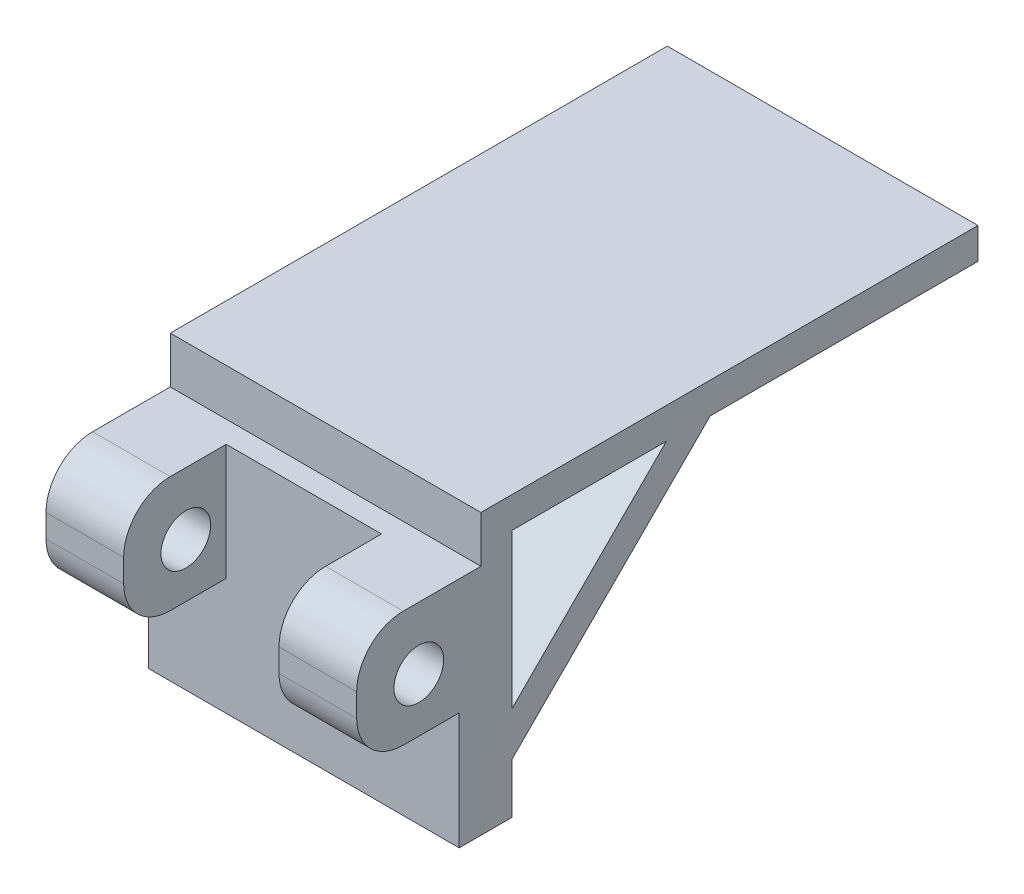
from build123d import *

# Parameters (mm, degrees)
BOSS_EXTRUDE1_DEPTH = 8
SKETCH1_3_W         = 10
SKETCH1_3_H         = 7.5
BOSS_EXTRUDE2_DEPTH = 2
SKETCH2_R           = 1.6
CUT_EXTRUDE1_DEPTH  = 23.808989456
CUT_EXTRUDE3_DEPTH  = 8
FILLET1_R           = 3
BOSS_EXTRUDE3_DEPTH = 3
SKETCH5_W           = 20
SKETCH5_H           = 2
BOSS_EXTRUDE4_DEPTH = 30
BOSS_EXTRUDE5_DEPTH = 20
BOSS_EXTRUDE6_DEPTH = 1.4


with BuildPart() as part:
    # Sketch1 → Boss-Extrude1 (new body)
    with BuildSketch(Plane.XY):
        Polygon((-10, 7.5), (-10, -7.5), (10, -7.5), (10, 7.5), (5, 7.5), (5, 0), (-5, 0), (-5, 7.5), align=None)
    extrude(amount=BOSS_EXTRUDE1_DEPTH)

    # Sketch1<3> → Boss-Extrude2 (add)
    with BuildSketch(Plane.XY):
        Polygon((-10, 7.5), (-10, -7.5), (10, -7.5), (10, 7.5), (5, 7.5), (5, 0), (-5, 0), (-5, 7.5), align=None)
        with Locations((0, 3.75)):
            Rectangle(SKETCH1_3_W, SKETCH1_3_H)
    extrude(amount=-BOSS_EXTRUDE2_DEPTH)

    # Sketch2 → Cut-Extrude1 (cut, through all)
    with BuildSketch(Plane(origin=(10, 0, 0), x_dir=(0, 0, -1), z_dir=(1, 0, 0))):
        with Locations(Location((-4, 3.5, 0), (0, 0, 90))):
            Circle(SKETCH2_R)
    extrude(amount=-CUT_EXTRUDE1_DEPTH, mode=Mode.SUBTRACT)

    # Sketch3 → Cut-Extrude3 (cut)
    with BuildSketch(Plane.XY.offset(8)):
        Polygon((10, -7.5), (10, 0.026252142), (5, 0.026252142), (5, 0), (-5, 0), (-5, 0.026252142), (-10, 0.026252142), (-10, -7.5), align=None)
    extrude(amount=-CUT_EXTRUDE3_DEPTH, mode=Mode.SUBTRACT)

    # Fillet1
    fillet1_edges = [part.edges().sort_by_distance(p)[0] for p in [
        (-7.5, 7.5, 8),
        (7.5, 0.026252142, 8),
        (7.5, 7.5, 8),
        (-7.5, 0.026252142, 8),
    ]]
    fillet(fillet1_edges, radius=FILLET1_R)

    # Sketch4 → Boss-Extrude3 (add)
    with BuildSketch(Plane(origin=(0, 7.5, 0), x_dir=(1, 0, 0), z_dir=(0, 1, 0))):
        Polygon((-5, 0), (5, 0), (10, 0), (10, 2), (-10, 2), (-10, 0), align=None)
    extrude(amount=BOSS_EXTRUDE3_DEPTH)

    # Sketch5 → Boss-Extrude4 (add)
    with BuildSketch(Plane(origin=(0, 0, -2), x_dir=(-1, 0, 0), z_dir=(0, 0, -1))):
        with Locations((0, 9.5)):
            Rectangle(SKETCH5_W, SKETCH5_H)
    extrude(amount=BOSS_EXTRUDE4_DEPTH)

    # Sketch8 → Boss-Extrude5 (add)
    with BuildSketch(Plane(origin=(10, 0, 0), x_dir=(0, 0, -1), z_dir=(1, 0, 0))):
        Polygon((14.757135199, 8.5), (11.934636095, 8.5), (2, -1.434636095), (2, -4.257135199), align=None)
    extrude(amount=-BOSS_EXTRUDE5_DEPTH)

    # Sketch9 → Boss-Extrude6 (add)
    with BuildSketch(Plane.XY):
        Polygon((-5, 7.5), (5, 7.5), (5, 0.026252142), (10, 0.026252142), (10, -7.5), (-10, -7.5), (-10, 0.026252142), (-5, 0.026252142), align=None)
    extrude(amount=BOSS_EXTRUDE6_DEPTH)


solid = part.part
